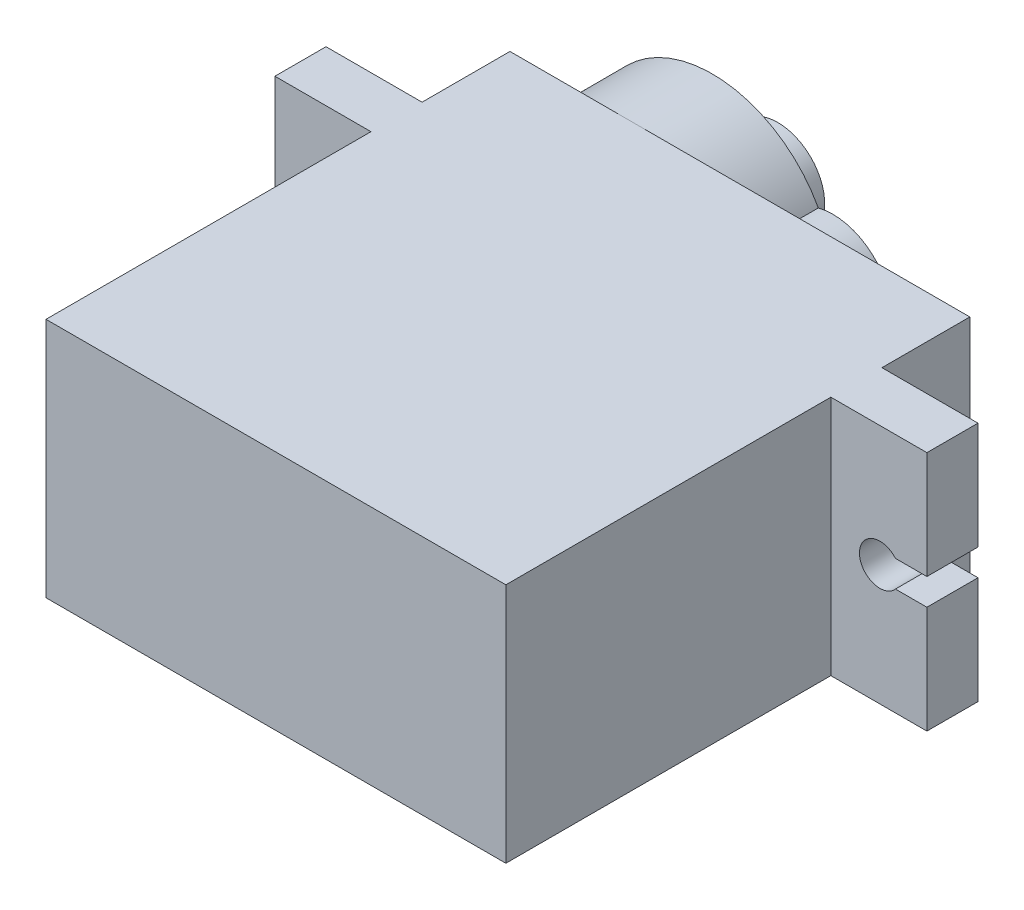
from build123d import *

# Parameters (mm, degrees)
SKETCH1_W           = 22.5
SKETCH1_H           = 22.7
BOSS_EXTRUDE1_DEPTH = 11.8
SKETCH2_W           = 4.7
SKETCH2_H           = 2.5
BOSS_EXTRUDE2_DEPTH = 11.8
SKETCH3_W           = 4.7
SKETCH3_H           = 2.5
BOSS_EXTRUDE3_DEPTH = 11.8
SKETCH4_R           = 5.9
BOSS_EXTRUDE4_DEPTH = 4
SKETCH5_R           = 2.9
BOSS_EXTRUDE5_DEPTH = 4
SKETCH6_R           = 1
SKETCH6_W           = 2.3
SKETCH6_H           = 1.3
CUT_EXTRUDE5_DEPTH  = 28.059240566
SKETCH8_R           = 1
SKETCH8_W           = 2.3
SKETCH8_H           = 1.3
CUT_EXTRUDE7_DEPTH  = 28.059240566
SKETCH9_R           = 2.3
SKETCH9_R_2         = 0.85
BOSS_EXTRUDE7_DEPTH = 3.2


with BuildPart() as part:
    # Sketch1 → Boss-Extrude1 (new body)
    with BuildSketch(Plane(origin=(0, 0, 0), x_dir=(1, 0, 0), z_dir=(0, 1, 0))):
        with Locations((0, -0.432106599)):
            Rectangle(SKETCH1_W, SKETCH1_H)
    extrude(amount=BOSS_EXTRUDE1_DEPTH)

    # Sketch2 → Boss-Extrude2 (add)
    with BuildSketch(Plane(origin=(0, 11.8, 0), x_dir=(1, 0, 0), z_dir=(0, 1, 0))):
        with Locations((13.6, 5.367893401)):
            Rectangle(SKETCH2_W, SKETCH2_H)
    extrude(amount=-BOSS_EXTRUDE2_DEPTH)

    # Sketch3 → Boss-Extrude3 (add)
    with BuildSketch(Plane(origin=(0, 11.8, 0), x_dir=(1, 0, 0), z_dir=(0, 1, 0))):
        with Locations((-13.6, 5.367893401)):
            Rectangle(SKETCH3_W, SKETCH3_H)
    extrude(amount=-BOSS_EXTRUDE3_DEPTH)

    # Sketch4 → Boss-Extrude4 (add)
    with BuildSketch(Plane(origin=(0, 0, -10.917893401), x_dir=(-1, 0, 0), z_dir=(0, 0, -1))):
        with Locations((5.35, 5.9)):
            Circle(SKETCH4_R)
    extrude(amount=BOSS_EXTRUDE4_DEPTH)

    # Sketch5 → Boss-Extrude5 (add)
    with BuildSketch(Plane(origin=(0, 0, -14.917893401), x_dir=(-1, 0, 0), z_dir=(0, 0, -1))):
        with Locations((-0.55, 5.9)):
            Circle(SKETCH5_R)
    extrude(amount=-BOSS_EXTRUDE5_DEPTH)

    # Sketch6 → Cut-Extrude5 (cut, through all)
    with BuildSketch(Plane(origin=(0, 0, -6.617893401), x_dir=(-1, 0, 0), z_dir=(0, 0, -1))):
        with Locations((-13.65, 5.9)):
            Circle(SKETCH6_R)
        with Locations((-14.8, 5.9)):
            Rectangle(SKETCH6_W, SKETCH6_H)
    extrude(amount=-CUT_EXTRUDE5_DEPTH, mode=Mode.SUBTRACT)

    # Sketch8 → Cut-Extrude7 (cut, through all)
    with BuildSketch(Plane(origin=(0, 0, -6.617893401), x_dir=(-1, 0, 0), z_dir=(0, 0, -1))):
        with Locations((13.65, 5.9)):
            Circle(SKETCH8_R)
        with Locations((14.8, 5.9)):
            Rectangle(SKETCH8_W, SKETCH8_H)
    extrude(amount=-CUT_EXTRUDE7_DEPTH, mode=Mode.SUBTRACT)

    # Sketch9 → Boss-Extrude7 (add)
    with BuildSketch(Plane(origin=(0, 0, -14.917893401), x_dir=(-1, 0, 0), z_dir=(0, 0, -1))):
        with Locations((5.35, 5.842855954)):
            Circle(SKETCH9_R)
        with Locations((5.35, 5.842855954)):
            Circle(SKETCH9_R_2, mode=Mode.SUBTRACT)
    extrude(amount=BOSS_EXTRUDE7_DEPTH)


solid = part.part
